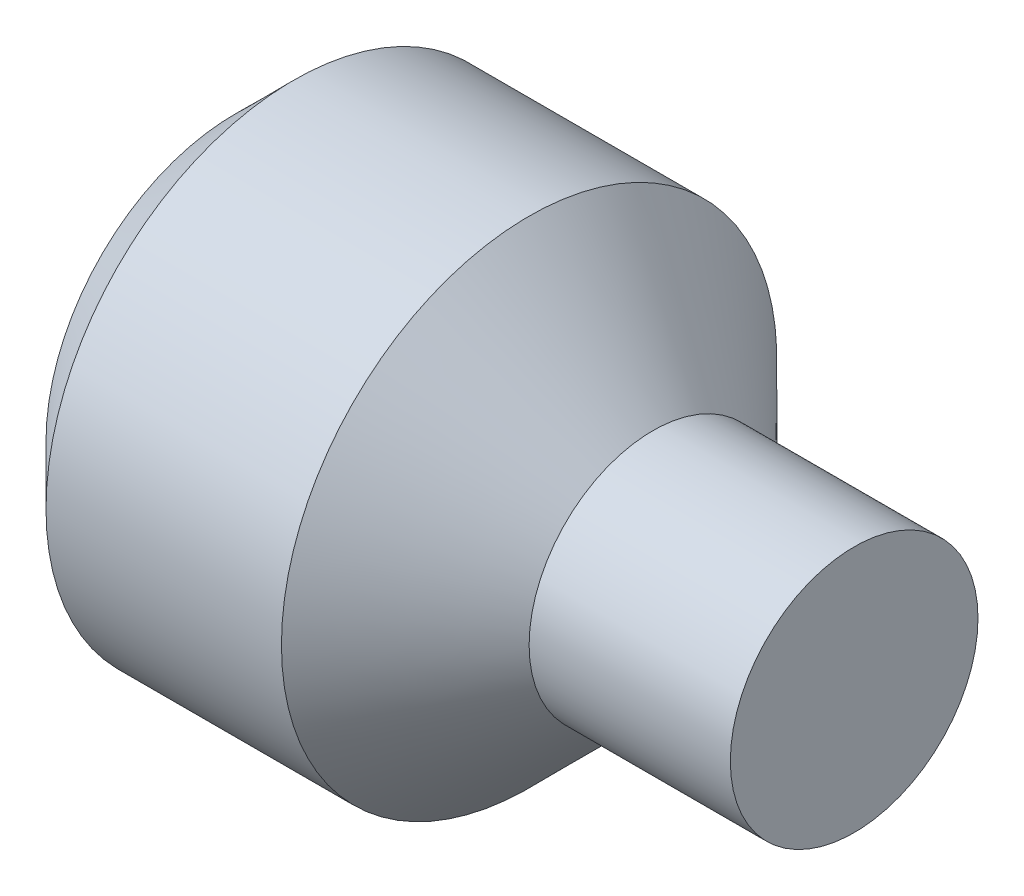
from build123d import *

# Parameters (mm, degrees)
HEXAGONSOCKET_DEPTH = 0.7


with BuildPart() as part:
    # Sketch1 → Base (revolve)
    with BuildSketch(Plane.XY, mode=Mode.PRIVATE) as base_sk:
        Polygon((0, 0), (2, 0), (2, 0.4), (1.35, 0.4), (0.95, 0.8), (0.1895, 0.8), (0, 0.6105), align=None)
    revolve(base_sk.sketch.rotate(Axis((-1.968820569, 0, 0), (1, 0, 0)), 90), axis=Axis((-1.968820569, 0, 0), (1, 0, 0)))

    # Sketch2 → HexagonSocket (cut)
    with BuildSketch(Plane(origin=(0, -1.128463942, -0.35035393), x_dir=(0, 0, 1), z_dir=(-1, 0, 0))):
        Polygon((0.754499118, 1.128463942), (0.552426524, 1.478463942), (0.148281336, 1.478463942), (-0.053791259, 1.128463942), (0.148281336, 0.778463942), (0.552426524, 0.778463942), align=None)
    extrude(amount=-HEXAGONSOCKET_DEPTH, mode=Mode.SUBTRACT)

    # Sketch3 → Cut-Revolve1 (revolve, cut)
    with BuildSketch(Plane.XY, mode=Mode.PRIVATE) as cut_revolve1_sk:
        Polygon((0.7, 0.35), (0.7, 0), (0.84, 0), align=None)
    revolve(cut_revolve1_sk.sketch.rotate(Axis((-0.330994676, 0, 0), (1, 0, 0)), 90), axis=Axis((-0.330994676, 0, 0), (1, 0, 0)), mode=Mode.SUBTRACT)


solid = part.part
